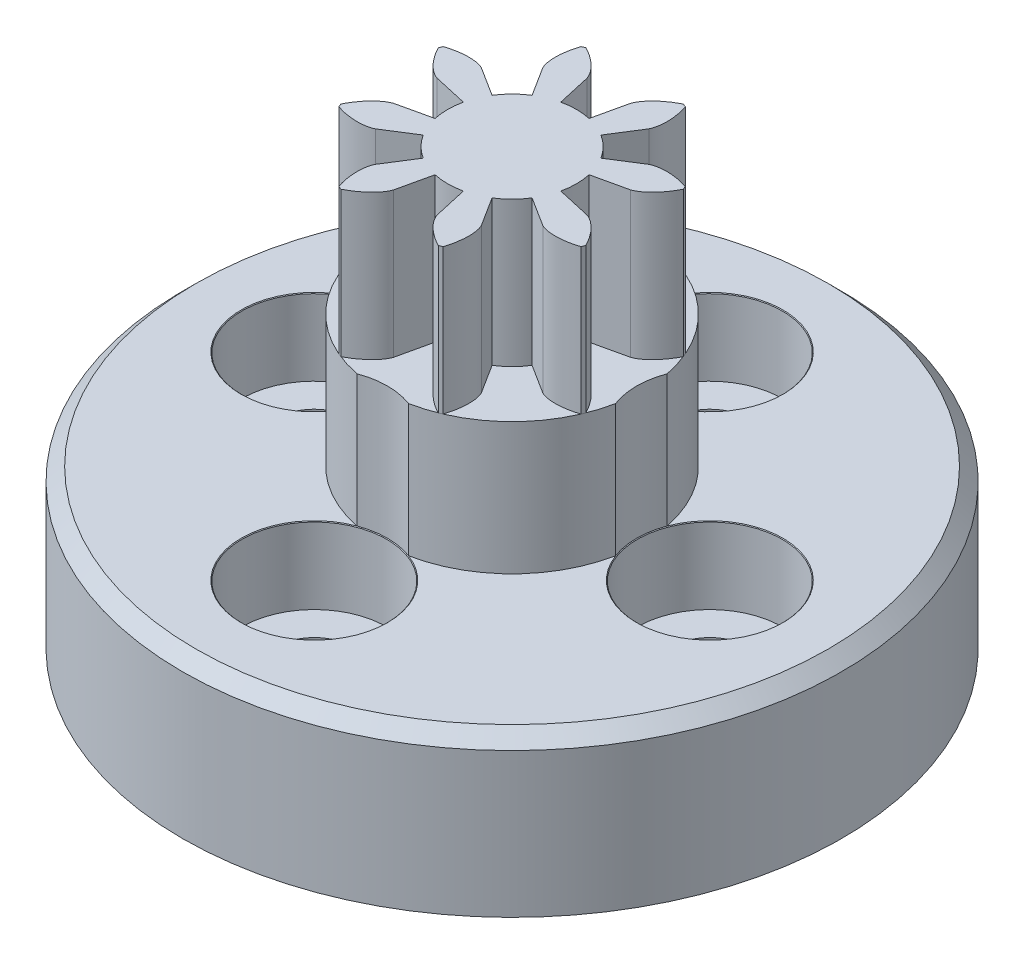
from build123d import *

# Parameters (mm, degrees)
SKETCH1_R                                    = 12.5
BOSS_EXTRUDE1_DEPTH                          = 5.98
CBORE_FOR_M2_5_HEX_SOCKET_HEAD_CAP_S_2_COUNT = 2
CBORE_FOR_M2_5_HEX_SOCKET_HEAD_CAP_S_2_PITCH = 10.606601718
CBORE_FOR_M2_5_HEX_SOCKET_HEAD_CAP_S_3_COUNT = 2
CBORE_FOR_M2_5_HEX_SOCKET_HEAD_CAP_S_3_PITCH = 15
CBORE_FOR_M2_5_HEX_SOCKET_HEAD_CAP_S_4_COUNT = 2
CBORE_FOR_M2_5_HEX_SOCKET_HEAD_CAP_S_4_PITCH = 10.606601718
BOSS_EXTRUDE2_DEPTH                          = 5
BOSS_EXTRUDE3_DEPTH                          = 5.5
F_0_5MM_CHAMFER_SIZE                         = 0.5


with BuildPart() as part:
    # Sketch1 → Boss-Extrude1 (new body)
    with BuildSketch(Plane(origin=(0, 0, 0), x_dir=(1, 0, 0), z_dir=(0, 1, 0))):
        with Locations(Location((0, 0, 0), (0, 0, 270))):
            Circle(SKETCH1_R)
    extrude(amount=BOSS_EXTRUDE1_DEPTH)

    # Sketch3 → CBORE for M2.5 Hex Socket Head Cap Screw1 (revolve, cut)
    with BuildSketch(Plane(origin=(-7.5, 5.98, 0), x_dir=(0, 0, 1), z_dir=(1, 0, 0))):
        Polygon((0, 0), (0, 5.98), (1.45, 5.98), (1.45, 2.9), (2.75, 2.9), (2.75, 0.025), (2.775, 0), align=None)
    cbore_for_m2_5_hex_socket_head_cap_screw = revolve(axis=Axis((-7.5, 12.33, 0), (0, -1, 0)), mode=Mode.SUBTRACT)

    # CBORE for M2.5 Hex Socket Head Cap S 2: CBORE for M2.5 Hex Socket Head Cap Screw1 ×2
    with Locations(*[Vector(0.7071067811865476, 0, -0.7071067811865476) * (i * CBORE_FOR_M2_5_HEX_SOCKET_HEAD_CAP_S_2_PITCH) for i in range(1, CBORE_FOR_M2_5_HEX_SOCKET_HEAD_CAP_S_2_COUNT)]):
        add(cbore_for_m2_5_hex_socket_head_cap_screw, mode=Mode.SUBTRACT)

    # CBORE for M2.5 Hex Socket Head Cap S 3: CBORE for M2.5 Hex Socket Head Cap Screw1 ×2
    with Locations(*[(i * CBORE_FOR_M2_5_HEX_SOCKET_HEAD_CAP_S_3_PITCH, 0, 0) for i in range(1, CBORE_FOR_M2_5_HEX_SOCKET_HEAD_CAP_S_3_COUNT)]):
        add(cbore_for_m2_5_hex_socket_head_cap_screw, mode=Mode.SUBTRACT)

    # CBORE for M2.5 Hex Socket Head Cap S 4: CBORE for M2.5 Hex Socket Head Cap Screw1 ×2
    with Locations(*[Vector(0.7071067811865476, 0, 0.7071067811865476) * (i * CBORE_FOR_M2_5_HEX_SOCKET_HEAD_CAP_S_4_PITCH) for i in range(1, CBORE_FOR_M2_5_HEX_SOCKET_HEAD_CAP_S_4_COUNT)]):
        add(cbore_for_m2_5_hex_socket_head_cap_screw, mode=Mode.SUBTRACT)

    # Sketch5 → Boss-Extrude2 (add)
    with BuildSketch(Plane(origin=(0, 5.98, 0), x_dir=(1, 0, 0), z_dir=(0, 1, 0))):
        with BuildLine():
            ThreePointArc((4.903291667, -0.978637232), (4.725, 0), (4.903291667, 0.978637232))
            ThreePointArc((4.903291667, 0.978637232), (3.535533906, 3.535533906), (0.978637232, 4.903291667))
            ThreePointArc((0.978637232, 4.903291667), (0, 4.725), (-0.978637232, 4.903291667))
            ThreePointArc((-0.978637232, 4.903291667), (-3.535533906, 3.535533906), (-4.903291667, 0.978637232))
            ThreePointArc((-4.903291667, 0.978637232), (-4.769936757, 0.497372785), (-4.725, 0))
            ThreePointArc((-4.725, 0), (-4.769936757, -0.497372785), (-4.903291667, -0.978637232))
            ThreePointArc((-4.903291667, -0.978637232), (-3.535533906, -3.535533906), (-0.978637232, -4.903291667))
            ThreePointArc((-0.978637232, -4.903291667), (0, -4.725), (0.978637232, -4.903291667))
            ThreePointArc((0.978637232, -4.903291667), (3.535533906, -3.535533906), (4.903291667, -0.978637232))
        make_face()
    extrude(amount=BOSS_EXTRUDE2_DEPTH)

    # 0,5mm Chamfer
    f_0_5mm_chamfer_edges = [part.edges().sort_by_distance(p)[0] for p in [
        (0, 5.98, -12.5),
    ]]
    chamfer(f_0_5mm_chamfer_edges, length=F_0_5MM_CHAMFER_SIZE)


with BuildPart() as body_2:
    # Sketch4 → Boss-Extrude3 (new body)
    with BuildSketch(Plane(origin=(0, 10.98, 0), x_dir=(1, 0, 0), z_dir=(0, 1, 0))):
        with BuildLine():
            Line((-2.009476748, 3.176532504), (-1.306159886, 2.064746127))
            ThreePointArc((-1.306159886, 2.064746127), (-1.727603863, 1.727603863), (-2.064746127, 1.306159886))
            Line((-2.064746127, 1.306159886), (-3.176532504, 2.009476748))
            add(Edge.make_bspline(
                [(-3.176532504, 2.009476748), (-3.709693798, 2.27301123), (-4.591724504, 1.978905274)],
                knots=[0.50407462, 0.50407462, 0.50407462, 1.738238777, 1.738238777, 1.738238777], degree=2, weights=[1, 0.815570405, 1]))
            ThreePointArc((-4.591724504, 1.978905274), (-4.619397663, 1.913417162), (-4.646136872, 1.847542195))
            add(Edge.make_bspline(
                [(-4.646136872, 1.847542195), (-4.230177813, 1.011711238), (-3.667062309, 0.825233039)],
                knots=[4.493136736, 4.493136736, 4.493136736, 5.781201385, 5.781201385, 5.781201385], degree=2, weights=[1, 0.799681158, 1]))
            Line((-3.667062309, 0.825233039), (-2.383590501, 0.536401475))
            ThreePointArc((-2.383590501, 0.536401475), (-2.443200814, 0), (-2.383590501, -0.536401475))
            Line((-2.383590501, -0.536401475), (-3.667062309, -0.825233039))
            add(Edge.make_bspline(
                [(-3.667062309, -0.825233039), (-4.230411296, -1.015887986), (-4.646136872, -1.847542195)],
                knots=[0.50407462, 0.50407462, 0.50407462, 1.738238777, 1.738238777, 1.738238777], degree=2, weights=[1, 0.815570405, 1]))
            ThreePointArc((-4.646136872, -1.847542195), (-4.619397663, -1.913417162), (-4.591724504, -1.978905274))
            add(Edge.make_bspline(
                [(-4.591724504, -1.978905274), (-3.706575294, -2.27579954), (-3.176532504, -2.009476748)],
                knots=[4.493136736, 4.493136736, 4.493136736, 5.781201385, 5.781201385, 5.781201385], degree=2, weights=[1, 0.799681158, 1]))
            Line((-3.176532504, -2.009476748), (-2.064746127, -1.306159886))
            ThreePointArc((-2.064746127, -1.306159886), (-1.727603863, -1.727603863), (-1.306159886, -2.064746127))
            Line((-1.306159886, -2.064746127), (-2.009476748, -3.176532504))
            add(Edge.make_bspline(
                [(-2.009476748, -3.176532504), (-2.27301123, -3.709693798), (-1.978905274, -4.591724504)],
                knots=[3.645667274, 3.645667274, 3.645667274, 4.87983143, 4.87983143, 4.87983143], degree=2, weights=[1, 0.815570405, 1]))
            ThreePointArc((-1.978905274, -4.591724504), (-1.913417162, -4.619397663), (-1.847542195, -4.646136872))
            add(Edge.make_bspline(
                [(-1.847542195, -4.646136872), (-1.011711238, -4.230177813), (-0.825233039, -3.667062309)],
                knots=[4.493136736, 4.493136736, 4.493136736, 5.781201385, 5.781201385, 5.781201385], degree=2, weights=[1, 0.799681158, 1]))
            Line((-0.825233039, -3.667062309), (-0.536401475, -2.383590501))
            ThreePointArc((-0.536401475, -2.383590501), (0, -2.443200814), (0.536401475, -2.383590501))
            Line((0.536401475, -2.383590501), (0.825233039, -3.667062309))
            add(Edge.make_bspline(
                [(0.825233039, -3.667062309), (1.015887986, -4.230411296), (1.847542195, -4.646136872)],
                knots=[3.645667274, 3.645667274, 3.645667274, 4.87983143, 4.87983143, 4.87983143], degree=2, weights=[1, 0.815570405, 1]))
            ThreePointArc((1.847542195, -4.646136872), (1.913417162, -4.619397663), (1.978905274, -4.591724504))
            add(Edge.make_bspline(
                [(1.978905274, -4.591724504), (2.27579954, -3.706575294), (2.009476748, -3.176532504)],
                knots=[4.493136736, 4.493136736, 4.493136736, 5.781201385, 5.781201385, 5.781201385], degree=2, weights=[1, 0.799681158, 1]))
            Line((2.009476748, -3.176532504), (1.306159886, -2.064746127))
            ThreePointArc((1.306159886, -2.064746127), (1.727603863, -1.727603863), (2.064746127, -1.306159886))
            Line((2.064746127, -1.306159886), (3.176532504, -2.009476748))
            add(Edge.make_bspline(
                [(3.176532504, -2.009476748), (3.709693798, -2.27301123), (4.591724504, -1.978905274)],
                knots=[0.50407462, 0.50407462, 0.50407462, 1.738238777, 1.738238777, 1.738238777], degree=2, weights=[1, 0.815570405, 1]))
            ThreePointArc((4.591724504, -1.978905274), (4.619397663, -1.913417162), (4.646136872, -1.847542195))
            add(Edge.make_bspline(
                [(4.646136872, -1.847542195), (4.230177813, -1.011711238), (3.667062309, -0.825233039)],
                knots=[4.493136736, 4.493136736, 4.493136736, 5.781201385, 5.781201385, 5.781201385], degree=2, weights=[1, 0.799681158, 1]))
            Line((3.667062309, -0.825233039), (2.383590501, -0.536401475))
            ThreePointArc((2.383590501, -0.536401475), (2.443200814, 0), (2.383590501, 0.536401475))
            Line((2.383590501, 0.536401475), (3.667062309, 0.825233039))
            add(Edge.make_bspline(
                [(3.667062309, 0.825233039), (4.230411296, 1.015887986), (4.646136872, 1.847542195)],
                knots=[0.50407462, 0.50407462, 0.50407462, 1.738238777, 1.738238777, 1.738238777], degree=2, weights=[1, 0.815570405, 1]))
            ThreePointArc((4.646136872, 1.847542195), (4.619397663, 1.913417162), (4.591724504, 1.978905274))
            add(Edge.make_bspline(
                [(4.591724504, 1.978905274), (3.706575294, 2.27579954), (3.176532504, 2.009476748)],
                knots=[1.351544083, 1.351544083, 1.351544083, 2.639608731, 2.639608731, 2.639608731], degree=2, weights=[1, 0.799681158, 1]))
            Line((3.176532504, 2.009476748), (2.064746127, 1.306159886))
            ThreePointArc((2.064746127, 1.306159886), (1.727603863, 1.727603863), (1.306159886, 2.064746127))
            Line((1.306159886, 2.064746127), (2.009476748, 3.176532504))
            add(Edge.make_bspline(
                [(2.009476748, 3.176532504), (2.27301123, 3.709693798), (1.978905274, 4.591724504)],
                knots=[0.50407462, 0.50407462, 0.50407462, 1.738238777, 1.738238777, 1.738238777], degree=2, weights=[1, 0.815570405, 1]))
            ThreePointArc((1.978905274, 4.591724504), (1.913417162, 4.619397663), (1.847542195, 4.646136872))
            add(Edge.make_bspline(
                [(1.847542195, 4.646136872), (1.011711238, 4.230177813), (0.825233039, 3.667062309)],
                knots=[1.351544083, 1.351544083, 1.351544083, 2.639608731, 2.639608731, 2.639608731], degree=2, weights=[1, 0.799681158, 1]))
            Line((0.825233039, 3.667062309), (0.536401475, 2.383590501))
            ThreePointArc((0.536401475, 2.383590501), (0, 2.443200814), (-0.536401475, 2.383590501))
            Line((-0.536401475, 2.383590501), (-0.825233039, 3.667062309))
            add(Edge.make_bspline(
                [(-0.825233039, 3.667062309), (-1.015887986, 4.230411296), (-1.847542195, 4.646136872)],
                knots=[0.50407462, 0.50407462, 0.50407462, 1.738238777, 1.738238777, 1.738238777], degree=2, weights=[1, 0.815570405, 1]))
            ThreePointArc((-1.847542195, 4.646136872), (-1.913417162, 4.619397663), (-1.978905274, 4.591724504))
            add(Edge.make_bspline(
                [(-1.978905274, 4.591724504), (-2.27579954, 3.706575294), (-2.009476748, 3.176532504)],
                knots=[1.351544083, 1.351544083, 1.351544083, 2.639608731, 2.639608731, 2.639608731], degree=2, weights=[1, 0.799681158, 1]))
        make_face()
    extrude(amount=BOSS_EXTRUDE3_DEPTH)


solid = Compound([part.part, body_2.part])
